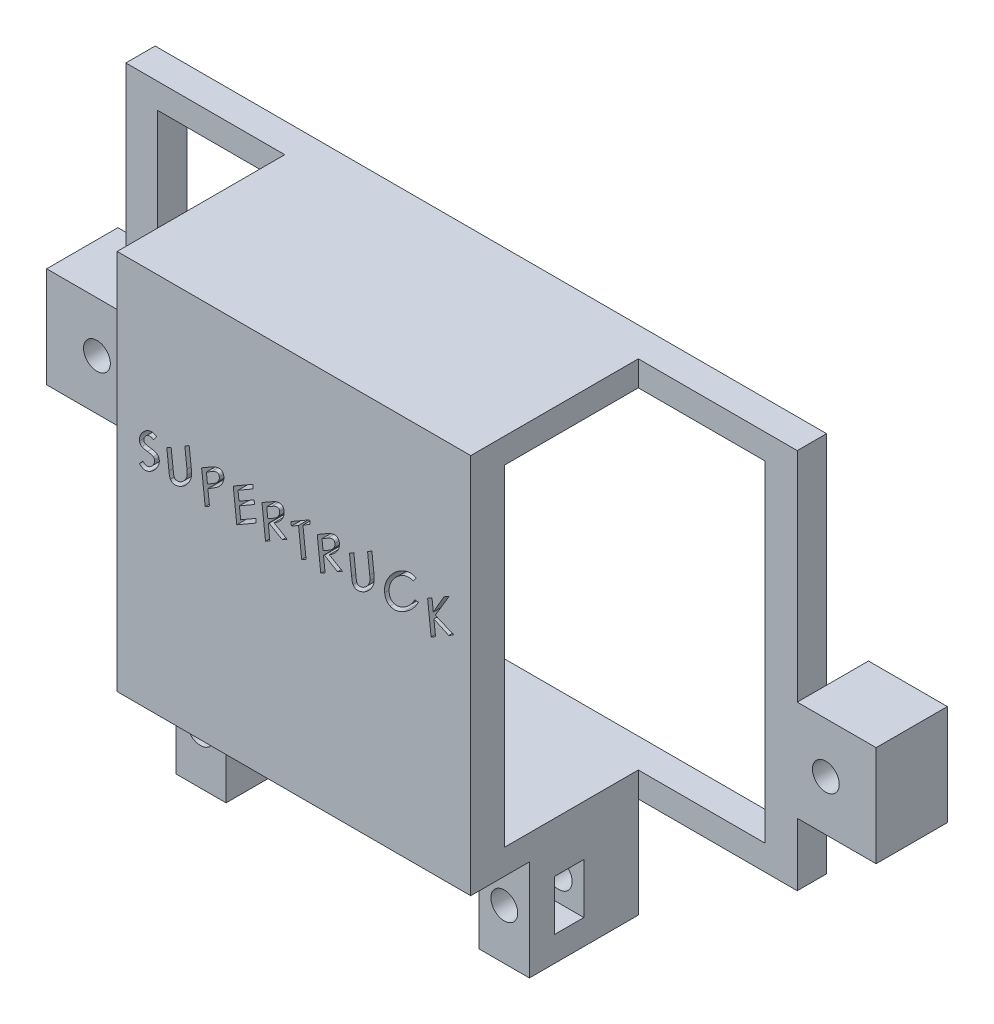
from build123d import *

# Parameters (mm, degrees)
ESBO_O1_W                  = 9.447833945
ESBO_O1_H                  = 12
ESBO_O1_R                  = 1.6
RESSALTO_EXTRUS_O1_DEPTH   = 5
ESBO_O1_W_2                = 9.41398894
RESSALTO_EXTRUS_O1_2_DEPTH = 5
ESBO_O2_W                  = 72.5
ESBO_O2_H                  = 39.5
ESBO_O2_W_2                = 9.447833945
ESBO_O2_H_2                = 12
ESBO_O2_R                  = 1.6
ESBO_O2_W_3                = 9.41398894
RESSALTO_EXTRUS_O2_DEPTH   = 3.5
ESBO_O4_W                  = 6
ESBO_O4_H                  = 12
RESSALTO_EXTRUS_O4_DEPTH   = 13
ESBO_O5_W                  = 42.2
ESBO_O5_H                  = 3
RESSALTO_EXTRUS_O5_DEPTH   = 16
ESBO_O6_W                  = 42.2
ESBO_O6_H                  = 3
RESSALTO_EXTRUS_O6_DEPTH   = 4
ESBO_O8_W                  = 42.2
ESBO_O8_H                  = 3
RESSALTO_EXTRUS_O7_DEPTH   = 10
RESSALTO_EXTRUS_O8_REACH   = 108.375
ESBO_O7_W                  = 42.2
ESBO_O7_H                  = 4
ESBO_O10_W                 = 42.2
ESBO_O10_H                 = 3
CORTE_EXTRUS_O1_DEPTH      = 3
ESBO_O11_R                 = 1.6
CORTE_EXTRUS_O4_DEPTH      = 99.089563665
CORTE_EXTRUS_O5_DEPTH      = 88.180679219
CORTE_EXTRUS_O7_DEPTH      = 100.85771127


with BuildPart() as part:
    # Esboço1 → Ressalto-extrusão1 (new body)
    with BuildSketch(Plane.XY):
        with Locations((-81.026083027, 10.5)):
            Rectangle(ESBO_O1_W, ESBO_O1_H)
        with Locations((-79.75, 10.5)):
            Circle(ESBO_O1_R, mode=Mode.SUBTRACT)
    extrude(amount=RESSALTO_EXTRUS_O1_DEPTH)



with BuildPart() as body_2:
    # Esboço1 → Ressalto-extrus_o1 2 (new body)
    with BuildSketch(Plane.XY):
        with Locations((8.54300553, 10.5)):
            Rectangle(ESBO_O1_W_2, ESBO_O1_H)
        with Locations((7.25, 10.5)):
            Circle(ESBO_O1_R, mode=Mode.SUBTRACT)
    extrude(amount=RESSALTO_EXTRUS_O1_2_DEPTH)


with BuildPart() as part_1:
    add(part.part)

    add(body_2.part)  # Ressalto-extrusão2 merges body 2
    # Esboço2 → Ressalto-extrusão2 (add)
    # profile 1 of 3: a face of its own
    with BuildSketch(Plane.XY.offset(5)):
        Polygon((-76.302166055, 42.5), (-76.302166055, 16.5), (-76.302166055, 4.5), (-76.302166055, -3), (3.83601106, -3), (3.83601106, 4.5), (3.83601106, 16.5), (3.83601106, 42.5), align=None)
        with Locations((-36.25, 19.75)):
            Rectangle(ESBO_O2_W, ESBO_O2_H, mode=Mode.SUBTRACT)
    # profile 2 of 3: a face of its own
    with BuildSketch(Plane.XY.offset(5)):
        with Locations((-81.026083027, 10.5)):
            Rectangle(ESBO_O2_W_2, ESBO_O2_H_2)
        with Locations((-79.75, 10.5)):
            Circle(ESBO_O2_R, mode=Mode.SUBTRACT)
    # profile 3 of 3: a face of its own
    with BuildSketch(Plane.XY.offset(5)):
        with Locations((8.54300553, 10.5)):
            Rectangle(ESBO_O2_W_3, ESBO_O2_H_2)
        with Locations((7.25, 10.5)):
            Circle(ESBO_O2_R, mode=Mode.SUBTRACT)
    extrude(amount=RESSALTO_EXTRUS_O2_DEPTH)

    # Esboço4 → Ressalto-extrusão4 (add)
    with BuildSketch(Plane.XY.offset(8.5)):
        Polygon((-57.333077498, -3), (-51.333077498, -3), (-21.133077498, -3), (-15.133077498, -3), (-15.133077498, 0), (-51.333077498, 0), (-57.333077498, 0), align=None)
        with Locations((-18.133077498, -9)):
            Rectangle(ESBO_O4_W, ESBO_O4_H)
        with Locations((-54.333077498, -9)):
            Rectangle(ESBO_O4_W, ESBO_O4_H)
    extrude(amount=RESSALTO_EXTRUS_O4_DEPTH)

    # Esboço5 → Ressalto-extrusão5 (add)
    with BuildSketch(Plane.XY.offset(8.5)):
        with Locations((-36.233077498, 41)):
            Rectangle(ESBO_O5_W, ESBO_O5_H)
    extrude(amount=RESSALTO_EXTRUS_O5_DEPTH)

    # Esboço6 → Ressalto-extrusão6 (add)
    with BuildSketch(Plane.XY.offset(24.5)):
        with Locations((-36.233077498, 41)):
            Rectangle(ESBO_O6_W, ESBO_O6_H)
    extrude(amount=RESSALTO_EXTRUS_O6_DEPTH)

    # Esboço8 → Ressalto-extrusão7 (add)
    with BuildSketch(Plane.XY.offset(21.5)):
        with Locations((-36.233077498, -1.5)):
            Rectangle(ESBO_O8_W, ESBO_O8_H)
    extrude(amount=RESSALTO_EXTRUS_O7_DEPTH)

    # Esboço7 → Ressalto-extrusão8 (add, up to next)
    with BuildSketch(Plane.XZ.offset(-39.5), mode=Mode.PRIVATE) as ressalto_extrus_o8_sk1:
        with Locations((-36.233077498, 26.5)):
            Rectangle(ESBO_O7_W, ESBO_O7_H)
    ressalto_extrus_o8_tool1 = extrude(ressalto_extrus_o8_sk1.sketch, amount=RESSALTO_EXTRUS_O8_REACH, mode=Mode.PRIVATE) - part_1.part
    add(ressalto_extrus_o8_tool1.solids().sort_by_distance((-36.233077, 39.5, 26.5))[0])

    # Esboço10 → Corte-extrusão1 (cut)
    with BuildSketch(Plane.XY.offset(31.5)):
        with Locations((-36.233077498, -1.5)):
            Rectangle(ESBO_O10_W, ESBO_O10_H)
    extrude(amount=-CORTE_EXTRUS_O1_DEPTH, mode=Mode.SUBTRACT)

    # Esboço11 → Corte-extrusão4 (cut, through all)
    with BuildSketch(Plane.XY.offset(21.5)):
        with Locations((-54.397427999, -9)):
            Circle(ESBO_O11_R)
        with Locations((-18.133077498, -9)):
            Circle(ESBO_O11_R)
    extrude(amount=-CORTE_EXTRUS_O4_DEPTH, mode=Mode.SUBTRACT)

    # Esboço12 → Corte-extrusão5 (cut, through all)
    with BuildSketch(Plane.ZY.offset(57.333077498)):
        Polygon((15, -12), (15, -9), (15, -6), (18.5, -6), (18.5, -12), align=None)
    extrude(amount=-CORTE_EXTRUS_O5_DEPTH, mode=Mode.SUBTRACT)

    # Esboço13 → Corte-extrusão7 (cut, through all)
    # profile 1 of 10: a face of its own
    with BuildSketch(Plane.XY.offset(28.5)):
        with BuildLine():
            Line((-54.669009291, 21.900403758), (-54.277082207, 22.35823629))
            add(Edge.make_bspline(
                [(-54.277082207, 22.35823629), (-54.242022549, 22.326985335), (-54.175384703, 22.267586687), (-54.068839593, 22.195816991), (-53.964018745, 22.142703869), (-53.859854956, 22.109527469), (-53.756649042, 22.096124495), (-53.654789807, 22.103505725), (-53.553811533, 22.13022005), (-53.491529533, 22.162756562), (-53.459574195, 22.179450233)],
                knots=[0, 0, 0, 0, 1.244732154, 2.365860707, 3.397277987, 4.352222213, 5.251935387, 6.14066621, 7.046022277, 8, 8, 8, 8], degree=3))
            add(Edge.make_bspline(
                [(-53.459574195, 22.179450233), (-53.4292957, 22.19807601), (-53.368340376, 22.235572598), (-53.283044445, 22.302023432), (-53.201895653, 22.376282946), (-53.125702509, 22.457168432), (-53.056674653, 22.543414447), (-52.997330885, 22.632192643), (-52.947087804, 22.721861171), (-52.909312279, 22.812756692), (-52.87995353, 22.901722419), (-52.862687278, 22.988090952), (-52.853434832, 23.070236638), (-52.857464585, 23.123389496), (-52.859413938, 23.149101675)],
                knots=[0, 0, 0, 0, 1.068901128, 2.151864326, 3.246859556, 4.376066674, 5.49179471, 6.566370356, 7.586054501, 8.578611649, 9.523706373, 10.399392065, 11.225721447, 12, 12, 12, 12], degree=3))
            add(Edge.make_bspline(
                [(-52.859413938, 23.149101675), (-52.863832356, 23.176298072), (-52.872493454, 23.229609167), (-52.905689237, 23.30319474), (-52.954852057, 23.367269786), (-52.997389449, 23.400062421), (-53.019269707, 23.416930201)],
                knots=[0, 0, 0, 0, 1.02312236, 2.005551405, 2.974101385, 4, 4, 4, 4], degree=3))
            add(Edge.make_bspline(
                [(-53.019269707, 23.416930201), (-53.037514948, 23.428537759), (-53.076152065, 23.453118556), (-53.142202638, 23.48385035), (-53.216889114, 23.514171366), (-53.301641771, 23.541162373), (-53.395502197, 23.56621271), (-53.498906214, 23.589250074), (-53.611858878, 23.610289242), (-53.690667572, 23.621923666), (-53.731609451, 23.627967861)],
                knots=[0, 0, 0, 0, 0.692751556, 1.46700844, 2.331209194, 3.276807417, 4.316630377, 5.445685829, 6.673009073, 8, 8, 8, 8], degree=3))
            add(Edge.make_bspline(
                [(-53.731609451, 23.627967861), (-53.773485697, 23.633768765), (-53.853195512, 23.644810562), (-53.966206977, 23.664827261), (-54.067189705, 23.684405158), (-54.156555475, 23.70336505), (-54.233599914, 23.724625845), (-54.298880044, 23.745159776), (-54.352366476, 23.76618952), (-54.38217528, 23.78353426), (-54.395571791, 23.791329239)],
                knots=[0, 0, 0, 0, 1.476295299, 2.81007097, 4.007383792, 5.068827152, 5.999416712, 6.796980535, 7.459345516, 8, 8, 8, 8], degree=3))
            add(Edge.make_bspline(
                [(-54.395571791, 23.791329239), (-54.415054177, 23.804456172), (-54.453496298, 23.830357881), (-54.505114113, 23.876295068), (-54.5496768, 23.928069733), (-54.587581185, 23.985182138), (-54.61930314, 24.047299558), (-54.644552562, 24.114555872), (-54.663916469, 24.187089182), (-54.670525041, 24.23783705), (-54.673917143, 24.263885329)],
                knots=[0, 0, 0, 0, 0.990566391, 1.954558924, 2.905548645, 3.865648694, 4.840427564, 5.842368085, 6.892513107, 8, 8, 8, 8], degree=3))
            add(Edge.make_bspline(
                [(-54.673917143, 24.263885329), (-54.676905814, 24.306881339), (-54.682971117, 24.394138788), (-54.671125734, 24.527433307), (-54.644305815, 24.664044422), (-54.600270608, 24.802538259), (-54.54281461, 24.941709764), (-54.468893529, 25.077239473), (-54.382404143, 25.20968327), (-54.282677224, 25.336783308), (-54.173148494, 25.456308654), (-54.055647525, 25.564929413), (-53.931446606, 25.660908555), (-53.84334589, 25.715470229), (-53.799618265, 25.742551194)],
                knots=[0, 0, 0, 0, 0.858427771, 1.742120176, 2.658956981, 3.630463543, 4.635439358, 5.657296797, 6.704438357, 7.786926772, 8.87551906, 9.934338066, 10.974736024, 12, 12, 12, 12], degree=3))
            add(Edge.make_bspline(
                [(-53.799618265, 25.742551194), (-53.774775931, 25.756652534), (-53.726017876, 25.784329237), (-53.651312666, 25.819816825), (-53.577833778, 25.851104651), (-53.504816417, 25.87604107), (-53.433337644, 25.896802513), (-53.362523527, 25.911489515), (-53.292752541, 25.92154424), (-53.223130617, 25.92566181), (-53.153125898, 25.924852116), (-53.082308014, 25.915153517), (-53.010197667, 25.899428148), (-52.936296451, 25.877996386), (-52.861473761, 25.847864368), (-52.784883535, 25.812345231), (-52.707333414, 25.769082614), (-52.656378579, 25.736293803), (-52.630147111, 25.719414175)],
                knots=[0, 0, 0, 0, 1.09813329, 2.155306438, 3.178468454, 4.167552244, 5.120578539, 6.038903103, 6.946389381, 7.828785665, 8.718701536, 9.633898418, 10.571674624, 11.555600292, 12.588661064, 13.670193192, 14.800619142, 16, 16, 16, 16], degree=3))
            Line((-52.630147111, 25.719414175), (-53.002442784, 25.21741097))
            add(Edge.make_bspline(
                [(-53.002442784, 25.21741097), (-53.025032075, 25.228796668), (-53.068730183, 25.25082186), (-53.132994454, 25.279844644), (-53.19275499, 25.305684846), (-53.248901457, 25.326191272), (-53.301245576, 25.341412629), (-53.349390881, 25.352957758), (-53.393423594, 25.360423269), (-53.447466156, 25.362967464), (-53.513609015, 25.358246273), (-53.593083284, 25.33889324), (-53.67494089, 25.309074972), (-53.727521474, 25.28009329), (-53.75474647, 25.265087252)],
                knots=[0, 0, 0, 0, 1.141766586, 2.208703196, 3.182545284, 4.080268655, 4.904840155, 5.641815856, 6.314772527, 6.916942086, 8.080482476, 9.293477405, 10.598625893, 12, 12, 12, 12], degree=3))
            add(Edge.make_bspline(
                [(-53.75474647, 25.265087252), (-53.784545656, 25.246498678), (-53.84390082, 25.209473241), (-53.922731277, 25.139261533), (-53.993435705, 25.05969771), (-54.053588864, 24.970765631), (-54.101965175, 24.876889788), (-54.134459472, 24.780334951), (-54.14930644, 24.682857285), (-54.145675288, 24.618442709), (-54.143869066, 24.586401354)],
                knots=[0, 0, 0, 0, 1.02092589, 2.033519409, 3.060210669, 4.113257883, 5.150893171, 6.125584599, 7.067620849, 8, 8, 8, 8], degree=3))
            add(Edge.make_bspline(
                [(-54.143869066, 24.586401354), (-54.141024416, 24.567155941), (-54.13547417, 24.529605879), (-54.120242187, 24.476124164), (-54.098246004, 24.427683459), (-54.069889333, 24.384203924), (-54.034198952, 24.345361183), (-53.989890278, 24.312850986), (-53.938796458, 24.283359763), (-53.900824054, 24.268735519), (-53.880948393, 24.261080842)],
                knots=[0, 0, 0, 0, 1.047632415, 2.044053817, 2.985222503, 3.903877644, 4.830697242, 5.810505775, 6.853966606, 8, 8, 8, 8], degree=3))
            add(Edge.make_bspline(
                [(-53.880948393, 24.261080842), (-53.871616848, 24.258448169), (-53.849353805, 24.252167183), (-53.81036017, 24.243133198), (-53.760362695, 24.234620283), (-53.699938294, 24.223715963), (-53.628600426, 24.212788727), (-53.546567974, 24.200867544), (-53.453785016, 24.188223358), (-53.38830089, 24.179927035), (-53.353704804, 24.175543983)],
                knots=[0, 0, 0, 0, 0.435328968, 1.038600545, 1.796036633, 2.712116024, 3.795558191, 5.036209249, 6.434192093, 8, 8, 8, 8], degree=3))
            add(Edge.make_bspline(
                [(-53.353704804, 24.175543983), (-53.308078342, 24.16960338), (-53.220307197, 24.158175506), (-53.094428653, 24.135751153), (-52.97943545, 24.109664644), (-52.874595021, 24.081843725), (-52.781543076, 24.048390722), (-52.698366154, 24.01401928), (-52.626722841, 23.974578081), (-52.564543821, 23.932218936), (-52.511605713, 23.885893146), (-52.464805, 23.837174314), (-52.4238104, 23.785249451), (-52.389405917, 23.729323593), (-52.36045628, 23.670478582), (-52.338125397, 23.608085543), (-52.320759525, 23.542693907), (-52.314842986, 23.497418687), (-52.311837816, 23.474422188)],
                knots=[0, 0, 0, 0, 1.610547672, 3.098193609, 4.473627786, 5.737929317, 6.891967107, 7.932906222, 8.884879262, 9.749493658, 10.561451409, 11.342613743, 12.111817593, 12.872358272, 13.637067771, 14.403132712, 15.188908249, 16, 16, 16, 16], degree=3))
            add(Edge.make_bspline(
                [(-52.311837816, 23.474422188), (-52.308958352, 23.439856188), (-52.303104524, 23.369584996), (-52.308857277, 23.261893621), (-52.325308793, 23.151231221), (-52.352325034, 23.037343079), (-52.389522394, 22.920050916), (-52.438467654, 22.799788877), (-52.498286964, 22.676561651), (-52.567934677, 22.551659971), (-52.645004099, 22.428170861), (-52.730482939, 22.310710808), (-52.821507135, 22.199705864), (-52.919180281, 22.095706052), (-53.023101152, 21.998923167), (-53.133112531, 21.908731938), (-53.248948988, 21.82502279), (-53.330902566, 21.775739369), (-53.37193397, 21.751064816)],
                knots=[0, 0, 0, 0, 0.78429709, 1.594442284, 2.433763078, 3.313926188, 4.240697132, 5.216067596, 6.249910937, 7.339092539, 8.451505446, 9.542355507, 10.624630763, 11.69861449, 12.768983967, 13.836369355, 14.916742806, 16, 16, 16, 16], degree=3))
            add(Edge.make_bspline(
                [(-53.37193397, 21.751064816), (-53.401910442, 21.734380612), (-53.460390366, 21.701832053), (-53.549250642, 21.659429619), (-53.636664221, 21.624464843), (-53.722548611, 21.596152487), (-53.80658897, 21.574739587), (-53.889465064, 21.561643076), (-53.970523533, 21.554155216), (-54.050649673, 21.554728059), (-54.129673636, 21.563852969), (-54.208478579, 21.582034859), (-54.286215331, 21.611451827), (-54.364243248, 21.649451393), (-54.441091521, 21.698560561), (-54.518499519, 21.756061227), (-54.595196664, 21.823832877), (-54.643885382, 21.874341011), (-54.669009291, 21.900403758)],
                knots=[0, 0, 0, 0, 1.142285649, 2.228440318, 3.276246117, 4.27549367, 5.238185986, 6.160714827, 7.066880425, 7.94638325, 8.823921012, 9.711206441, 10.632158084, 11.585873758, 12.596483439, 13.664302693, 14.794754733, 16, 16, 16, 16], degree=3))
        make_face()
    # profile 2 of 10: a face of its own
    with BuildSketch(Plane.XY.offset(28.5)):
        with BuildLine():
            Line((-51.412298554, 25.180952637), (-50.894169547, 25.480331643))
            Line((-50.894169547, 25.480331643), (-50.640363457, 23.198180201))
            add(Edge.make_bspline(
                [(-50.640363457, 23.198180201), (-50.636581115, 23.16640103), (-50.629434353, 23.106354073), (-50.619934386, 23.020957503), (-50.610177695, 22.945716274), (-50.60065661, 22.880370914), (-50.593647999, 22.825032466), (-50.585520871, 22.779792068), (-50.57911287, 22.744349748), (-50.5738471, 22.724201587), (-50.571653522, 22.715808406)],
                knots=[0, 0, 0, 0, 1.575509933, 2.976936662, 4.229903835, 5.310298412, 6.22798457, 6.975119685, 7.573062485, 8, 8, 8, 8], degree=3))
            add(Edge.make_bspline(
                [(-50.571653522, 22.715808406), (-50.562573835, 22.683902069), (-50.545525977, 22.6239953), (-50.506719672, 22.544199577), (-50.462600611, 22.47807775), (-50.407990702, 22.42734692), (-50.343368936, 22.392224531), (-50.268240439, 22.371214719), (-50.18258373, 22.364563087), (-50.08820519, 22.370047962), (-49.98895764, 22.386627467), (-49.889049198, 22.414826386), (-49.790707317, 22.45444046), (-49.727903621, 22.48826415), (-49.6959524, 22.505471867)],
                knots=[0, 0, 0, 0, 1.099677346, 2.064734564, 2.934582102, 3.725574806, 4.514126639, 5.35424021, 6.297260244, 7.354227996, 8.487307601, 9.632339741, 10.795458842, 12, 12, 12, 12], degree=3))
            add(Edge.make_bspline(
                [(-49.6959524, 22.505471867), (-49.665951558, 22.523683356), (-49.605249606, 22.560531418), (-49.519075127, 22.625507108), (-49.436340657, 22.698865266), (-49.356729646, 22.77901363), (-49.282562902, 22.865069446), (-49.21498952, 22.954951514), (-49.15519554, 23.04772155), (-49.102997681, 23.143484073), (-49.058646873, 23.242325649), (-49.022983626, 23.344674784), (-48.99431773, 23.449790963), (-48.982523049, 23.521735418), (-48.976601438, 23.557855681)],
                knots=[0, 0, 0, 0, 0.958861267, 1.940103884, 2.944915544, 3.9793654, 5.025661686, 6.047788545, 7.050750526, 8.039843127, 9.026415636, 10.008344256, 11.000074001, 12, 12, 12, 12], degree=3))
            add(Edge.make_bspline(
                [(-48.976601438, 23.557855681), (-48.975093094, 23.572569491), (-48.971818449, 23.604513454), (-48.968920496, 23.656910075), (-48.969401162, 23.717730255), (-48.971494007, 23.787160261), (-48.975878841, 23.864993299), (-48.982035308, 23.951513237), (-48.991555491, 24.046328966), (-48.99832463, 24.112444744), (-49.001841823, 24.146797989)],
                knots=[0, 0, 0, 0, 0.601060134, 1.304913073, 2.131209579, 3.07190963, 4.127689037, 5.299024443, 6.596594039, 8, 8, 8, 8], degree=3))
            Line((-49.001841823, 24.146797989), (-49.255647913, 26.428949431))
            Line((-49.255647913, 26.428949431), (-48.738220028, 26.728328438))
            Line((-48.738220028, 26.728328438), (-48.484413938, 24.446176996))
            add(Edge.make_bspline(
                [(-48.484413938, 24.446176996), (-48.48014347, 24.405771242), (-48.471736999, 24.326231998), (-48.464429532, 24.208339904), (-48.459815532, 24.094256815), (-48.460002577, 23.983872474), (-48.463452898, 23.8772472), (-48.470175137, 23.774294975), (-48.481428304, 23.675096912), (-48.49688752, 23.578890896), (-48.517340773, 23.483480032), (-48.544564622, 23.387305649), (-48.580361448, 23.289868278), (-48.621451508, 23.1898455), (-48.670870683, 23.088516222), (-48.726833574, 22.985087896), (-48.791350105, 22.880984476), (-48.86026821, 22.774905619), (-48.936513032, 22.670960811), (-49.018116804, 22.570519911), (-49.106514652, 22.476059146), (-49.198630869, 22.384844513), (-49.298186448, 22.300544621), (-49.4015745, 22.219650514), (-49.510938805, 22.144060687), (-49.587255252, 22.098179989), (-49.62584022, 22.074983085)],
                knots=[0, 0, 0, 0, 1.043143646, 2.053441638, 3.032239226, 3.974369395, 4.886988775, 5.771149395, 6.622696436, 7.449418184, 8.272144766, 9.126920693, 10.013359138, 10.936102475, 11.902310503, 12.906602635, 13.954293092, 15.046114224, 16.153945941, 17.262687422, 18.366742133, 19.474297524, 20.589257385, 21.713976697, 22.844205419, 24, 24, 24, 24], degree=3))
            add(Edge.make_bspline(
                [(-49.62584022, 22.074983085), (-49.664855846, 22.053012992), (-49.740679123, 22.010316137), (-49.855389294, 21.955776127), (-49.966415287, 21.909715235), (-50.074079906, 21.873086631), (-50.178613684, 21.84607646), (-50.279433727, 21.828488282), (-50.377019317, 21.819517658), (-50.470536976, 21.820921251), (-50.559121712, 21.831297561), (-50.641742515, 21.850101732), (-50.717945653, 21.877347428), (-50.787736814, 21.913380726), (-50.850534533, 21.958792299), (-50.907016911, 22.012422022), (-50.956986875, 22.074892377), (-50.98360505, 22.121785521), (-50.997234451, 22.145796387)],
                knots=[0, 0, 0, 0, 1.393156829, 2.707472038, 3.950118529, 5.132355118, 6.243735769, 7.306773745, 8.314291815, 9.289037128, 10.211957887, 11.085312262, 11.920488359, 12.724027213, 13.521353386, 14.323937037, 15.141799419, 16, 16, 16, 16], degree=3))
            add(Edge.make_bspline(
                [(-50.997234451, 22.145796387), (-51.005542052, 22.162705341), (-51.023800929, 22.199868724), (-51.045085471, 22.264218215), (-51.066817043, 22.339987807), (-51.087803652, 22.427921582), (-51.107225147, 22.528294722), (-51.125044661, 22.641085564), (-51.142633757, 22.765898559), (-51.153051854, 22.853206592), (-51.158492464, 22.898801194)],
                knots=[0, 0, 0, 0, 0.584117281, 1.283803392, 2.098809302, 3.031238358, 4.088179357, 5.271115745, 6.574903274, 8, 8, 8, 8], degree=3))
            Line((-51.158492464, 22.898801194), (-51.412298554, 25.180952637))
        make_face()
    # profile 3 of 10: a face of its own
    with BuildSketch(Plane.XY.offset(28.5)):
        with BuildLine():
            Line((-47.25464631, 25.171838053), (-46.445551759, 25.640187412))
            add(Edge.make_bspline(
                [(-46.445551759, 25.640187412), (-46.391870278, 25.67116174), (-46.289250778, 25.730373408), (-46.141312753, 25.813129491), (-46.006923953, 25.886071699), (-45.885978867, 25.949192164), (-45.779195508, 26.00378992), (-45.684871695, 26.047010993), (-45.60480454, 26.082130744), (-45.554984849, 26.099889041), (-45.532691182, 26.107835649)],
                knots=[0, 0, 0, 0, 1.448514325, 2.769033443, 3.961755183, 5.022105838, 5.957697331, 6.764187835, 7.446990051, 8, 8, 8, 8], degree=3))
            add(Edge.make_bspline(
                [(-45.532691182, 26.107835649), (-45.501745826, 26.117671548), (-45.441823636, 26.136717656), (-45.352227656, 26.15648333), (-45.266815941, 26.167751333), (-45.185401613, 26.171483498), (-45.108009231, 26.167710767), (-45.034660481, 26.15487833), (-44.965244324, 26.134748881), (-44.900518707, 26.1057383), (-44.840910039, 26.069525042), (-44.787152333, 26.02546003), (-44.741301565, 25.973022334), (-44.700259739, 25.914244883), (-44.667868702, 25.846975972), (-44.641162958, 25.772740935), (-44.620542394, 25.691038668), (-44.613144588, 25.633516046), (-44.609313778, 25.603729079)],
                knots=[0, 0, 0, 0, 1.242708276, 2.406364398, 3.507338927, 4.537303467, 5.523020175, 6.467422244, 7.381890335, 8.28313013, 9.174724031, 10.045419717, 10.932647778, 11.833576593, 12.781954752, 13.781103496, 14.850987742, 16, 16, 16, 16], degree=3))
            add(Edge.make_bspline(
                [(-44.609313778, 25.603729079), (-44.606421388, 25.572673073), (-44.600622982, 25.510414759), (-44.601970785, 25.41635974), (-44.609593639, 25.321939221), (-44.624446163, 25.227287745), (-44.646069896, 25.132282582), (-44.675874576, 25.037544524), (-44.712540818, 24.942525956), (-44.756064434, 24.847591489), (-44.805422351, 24.752821419), (-44.862673671, 24.660610888), (-44.925115095, 24.569429916), (-44.994907578, 24.480851503), (-45.069893086, 24.392598843), (-45.152044376, 24.306962366), (-45.239627587, 24.222051358), (-45.302405832, 24.16888087), (-45.334273714, 24.141890137)],
                knots=[0, 0, 0, 0, 0.880416654, 1.764980882, 2.652495797, 3.554353694, 4.46868734, 5.401958865, 6.35692225, 7.34355168, 8.350421546, 9.372730919, 10.40726391, 11.470216121, 12.556363338, 13.676947293, 14.820757557, 16, 16, 16, 16], degree=3))
            add(Edge.make_bspline(
                [(-45.334273714, 24.141890137), (-45.358211093, 24.122784362), (-45.409990876, 24.081455994), (-45.497008389, 24.018439412), (-45.598127754, 23.948620487), (-45.71480857, 23.872960129), (-45.845176064, 23.78939114), (-45.991490488, 23.701015715), (-46.151287501, 23.604304168), (-46.26361372, 23.539201067), (-46.322154323, 23.505271547)],
                knots=[0, 0, 0, 0, 0.624846737, 1.351627822, 2.191560067, 3.131936521, 4.188904282, 5.351037701, 6.619451005, 8, 8, 8, 8], degree=3))
            Line((-46.322154323, 23.505271547), (-46.505848233, 23.399402156))
            Line((-46.505848233, 23.399402156), (-46.314441983, 21.676044784))
            Line((-46.314441983, 21.676044784), (-46.83257099, 21.375964656))
            Line((-46.83257099, 21.375964656), (-47.25464631, 25.171838053))
        make_face()
        with BuildLine():
            Line((-46.686737656, 25.022499111), (-46.556329002, 23.85022347))
            Line((-46.556329002, 23.85022347), (-45.996132688, 24.167130521))
            add(Edge.make_bspline(
                [(-45.996132688, 24.167130521), (-45.964976873, 24.185473192), (-45.904700958, 24.220960028), (-45.818514497, 24.274354984), (-45.738903888, 24.325249338), (-45.667191429, 24.375322546), (-45.601041721, 24.421803452), (-45.543543922, 24.468624207), (-45.490970806, 24.511307157), (-45.432760289, 24.56761506), (-45.367629121, 24.637401291), (-45.301767536, 24.727309641), (-45.245059383, 24.820671011), (-45.199902588, 24.917890651), (-45.165160642, 25.015676233), (-45.144407969, 25.112289863), (-45.133808447, 25.205810889), (-45.138002481, 25.266715691), (-45.140062977, 25.296637733)],
                knots=[0, 0, 0, 0, 1.155068263, 2.234664564, 3.239168387, 4.173268604, 5.02912506, 5.820926034, 6.541774964, 7.191389232, 8.406901199, 9.586684072, 10.745583338, 11.891346545, 13.00593204, 14.053126756, 15.043516771, 16, 16, 16, 16], degree=3))
            add(Edge.make_bspline(
                [(-45.140062977, 25.296637733), (-45.144243135, 25.323734188), (-45.15224255, 25.375587671), (-45.179305893, 25.44766529), (-45.218979267, 25.508988723), (-45.270152586, 25.558651057), (-45.330335339, 25.595823227), (-45.398836188, 25.617829586), (-45.474126806, 25.624595723), (-45.541095863, 25.616825428), (-45.600120526, 25.603023003), (-45.651686436, 25.585718973), (-45.710227653, 25.5631647), (-45.775085293, 25.534234474), (-45.846719618, 25.499593078), (-45.925280305, 25.459851038), (-46.010036447, 25.41317784), (-46.068621899, 25.379907133), (-46.099197592, 25.362543181)],
                knots=[0, 0, 0, 0, 1.096166979, 2.097694186, 3.058485907, 3.99862096, 4.931502678, 5.867058289, 6.854528122, 7.937016616, 8.552428615, 9.280750377, 10.11355746, 11.065090751, 12.124499655, 13.301038159, 14.591414341, 16, 16, 16, 16], degree=3))
            Line((-46.099197592, 25.362543181), (-46.686737656, 25.022499111))
        make_face(mode=Mode.SUBTRACT)
    # profile 4 of 10: a face of its own
    with BuildSketch(Plane.XY.offset(28.5)):
        Polygon((-43.480507688, 25.17464254), (-41.147875477, 26.524301996), (-41.097394707, 26.069273951), (-42.911897913, 25.019694624), (-42.792707207, 23.950483887), (-40.993628682, 24.991649752), (-40.943147913, 24.539426194), (-42.742226438, 23.498260329), (-42.590784131, 22.133877316), (-40.791705605, 23.175043181), (-40.741224836, 22.720015137), (-43.058432368, 21.378769143), align=None)
    # profile 5 of 10: a face of its own
    with BuildSketch(Plane.XY.offset(28.5)):
        with BuildLine():
            Line((-40.052022111, 25.185159367), (-39.24292756, 25.653508726))
            add(Edge.make_bspline(
                [(-39.24292756, 25.653508726), (-39.190893373, 25.683568383), (-39.091567002, 25.740948287), (-38.948019416, 25.820855829), (-38.81780131, 25.892489923), (-38.700311347, 25.955290175), (-38.594893387, 26.007419223), (-38.503359996, 26.052343326), (-38.424096971, 26.086738101), (-38.375225706, 26.105632024), (-38.353204002, 26.114145746)],
                knots=[0, 0, 0, 0, 1.43813675, 2.745212607, 3.931699675, 4.995061015, 5.933061402, 6.74609127, 7.434980734, 8, 8, 8, 8], degree=3))
            add(Edge.make_bspline(
                [(-38.353204002, 26.114145746), (-38.321094526, 26.124682984), (-38.25886438, 26.145104803), (-38.165997766, 26.166818513), (-38.077384781, 26.180520341), (-37.993115163, 26.185559729), (-37.913083612, 26.18260256), (-37.837687714, 26.169531397), (-37.766337294, 26.149642769), (-37.700077095, 26.120418783), (-37.638775664, 26.084358893), (-37.584411471, 26.039670636), (-37.536775514, 25.987720982), (-37.496040269, 25.928469477), (-37.462224804, 25.861952389), (-37.435799412, 25.788138257), (-37.415165848, 25.707404981), (-37.40772466, 25.650578792), (-37.403885092, 25.621257124)],
                knots=[0, 0, 0, 0, 1.270489198, 2.462286483, 3.582300532, 4.638849111, 5.633049086, 6.586754278, 7.510376654, 8.411774492, 9.302654511, 10.177123272, 11.048050942, 11.945282281, 12.872994272, 13.846224994, 14.888676548, 16, 16, 16, 16], degree=3))
            add(Edge.make_bspline(
                [(-37.403885092, 25.621257124), (-37.400069564, 25.570312018), (-37.392322032, 25.466866613), (-37.408403565, 25.308970316), (-37.442276298, 25.147682121), (-37.496544609, 24.984345172), (-37.569947499, 24.82095046), (-37.664399294, 24.661308899), (-37.777156215, 24.504712726), (-37.910050711, 24.353426837), (-38.059923803, 24.206690479), (-38.228379152, 24.067893952), (-38.412130377, 23.934162687), (-38.544459319, 23.853953196), (-38.611917945, 23.813064015)],
                knots=[0, 0, 0, 0, 0.80008107, 1.624586081, 2.478812466, 3.381966318, 4.318933115, 5.283496082, 6.286760888, 7.341785163, 8.438457194, 9.573500909, 10.763019705, 12, 12, 12, 12], degree=3))
            Line((-38.611917945, 23.813064015), (-37.041405124, 22.887583246))
            Line((-37.041405124, 22.887583246), (-37.627542945, 22.548240297))
            Line((-37.627542945, 22.548240297), (-39.1959524, 23.474422188))
            Line((-39.1959524, 23.474422188), (-39.303224034, 23.41272347))
            Line((-39.303224034, 23.41272347), (-39.111817784, 21.689366098))
            Line((-39.111817784, 21.689366098), (-39.629946791, 21.38928597))
            Line((-39.629946791, 21.38928597), (-40.052022111, 25.185159367))
        make_face()
        with BuildLine():
            Line((-39.483412336, 25.033015938), (-39.353003682, 23.86214254))
            Line((-39.353003682, 23.86214254), (-38.782991663, 24.187463053))
            add(Edge.make_bspline(
                [(-38.782991663, 24.187463053), (-38.752556489, 24.205367284), (-38.693722721, 24.239977679), (-38.609272053, 24.291649939), (-38.532216162, 24.342742512), (-38.460570461, 24.390199143), (-38.396551208, 24.437922375), (-38.338299604, 24.482904132), (-38.2871837, 24.527051981), (-38.228391198, 24.582932488), (-38.164028625, 24.653832437), (-38.096763257, 24.742932138), (-38.041288124, 24.837081757), (-37.995595095, 24.933821644), (-37.962158322, 25.031754359), (-37.940933395, 25.12813334), (-37.930329801, 25.221732883), (-37.935102504, 25.282847476), (-37.937438778, 25.312763534)],
                knots=[0, 0, 0, 0, 1.135607923, 2.195226257, 3.183340362, 4.108903771, 4.958241504, 5.750597167, 6.47533301, 7.129222298, 8.358284299, 9.550317902, 10.712987507, 11.866290821, 12.985766561, 14.032511952, 15.036899638, 16, 16, 16, 16], degree=3))
            add(Edge.make_bspline(
                [(-37.937438778, 25.312763534), (-37.941603169, 25.339862506), (-37.949539184, 25.391504592), (-37.976528956, 25.462989343), (-38.01640044, 25.523125181), (-38.067803974, 25.571309795), (-38.127578774, 25.607605452), (-38.195576862, 25.629167116), (-38.270089137, 25.634644413), (-38.336629169, 25.628148211), (-38.395390604, 25.614201786), (-38.446957245, 25.596944927), (-38.505511597, 25.574402659), (-38.5704969, 25.545257461), (-38.642890238, 25.510975425), (-38.722051911, 25.470101084), (-38.808000208, 25.423212403), (-38.867189275, 25.389297911), (-38.897975637, 25.371657765)],
                knots=[0, 0, 0, 0, 1.097516208, 2.091519411, 3.037838851, 3.966160081, 4.895332766, 5.820240342, 6.798741918, 7.872299426, 8.488468912, 9.217687136, 10.051519288, 11.004223784, 12.073393632, 13.263992927, 14.576904327, 16, 16, 16, 16], degree=3))
            Line((-38.897975637, 25.371657765), (-39.483412336, 25.033015938))
        make_face(mode=Mode.SUBTRACT)
    # profile 6 of 10: a face of its own
    with BuildSketch(Plane.XY.offset(28.5)):
        Polygon((-36.544309772, 24.503668983), (-36.594089419, 24.953088053), (-34.355407528, 26.24876113), (-34.305627881, 25.79934206), (-35.16099647, 25.304350072), (-34.788700797, 21.957895746), (-35.314542143, 21.653608887), (-35.686837816, 25.000063213), align=None)
    # profile 7 of 10: a face of its own
    with BuildSketch(Plane.XY.offset(28.5)):
        with BuildLine():
            Line((-33.455868265, 25.185159367), (-32.646773714, 25.653508726))
            add(Edge.make_bspline(
                [(-32.646773714, 25.653508726), (-32.594739527, 25.683568383), (-32.495413156, 25.740948287), (-32.35186557, 25.820855829), (-32.221647464, 25.892489923), (-32.104157501, 25.955290175), (-31.998739541, 26.007419223), (-31.90720615, 26.052343326), (-31.827943125, 26.086738101), (-31.77907186, 26.105632024), (-31.757050156, 26.114145746)],
                knots=[0, 0, 0, 0, 1.43813675, 2.745212607, 3.931699675, 4.995061015, 5.933061402, 6.74609127, 7.434980734, 8, 8, 8, 8], degree=3))
            add(Edge.make_bspline(
                [(-31.757050156, 26.114145746), (-31.72494068, 26.124682984), (-31.662710534, 26.145104803), (-31.56984392, 26.166818513), (-31.481230935, 26.180520341), (-31.396961317, 26.185559729), (-31.316929766, 26.18260256), (-31.241533868, 26.169531397), (-31.170183448, 26.149642769), (-31.103923249, 26.120418783), (-31.042621817, 26.084358893), (-30.988257625, 26.039670636), (-30.940621668, 25.987720982), (-30.899886423, 25.928469477), (-30.866070957, 25.861952389), (-30.839645566, 25.788138257), (-30.819012002, 25.707404981), (-30.811570814, 25.650578792), (-30.807731246, 25.621257124)],
                knots=[0, 0, 0, 0, 1.270489198, 2.462286483, 3.582300532, 4.638849111, 5.633049086, 6.586754278, 7.510376654, 8.411774492, 9.302654511, 10.177123272, 11.048050942, 11.945282281, 12.872994272, 13.846224994, 14.888676548, 16, 16, 16, 16], degree=3))
            add(Edge.make_bspline(
                [(-30.807731246, 25.621257124), (-30.803915718, 25.570312018), (-30.796168186, 25.466866613), (-30.812249719, 25.308970316), (-30.846122452, 25.147682121), (-30.900390763, 24.984345172), (-30.973793653, 24.82095046), (-31.068245448, 24.661308899), (-31.181002369, 24.504712726), (-31.313896865, 24.353426837), (-31.463769956, 24.206690479), (-31.632225306, 24.067893952), (-31.815976531, 23.934162687), (-31.948305473, 23.853953196), (-32.015764098, 23.813064015)],
                knots=[0, 0, 0, 0, 0.80008107, 1.624586081, 2.478812466, 3.381966318, 4.318933115, 5.283496082, 6.286760888, 7.341785163, 8.438457194, 9.573500909, 10.763019705, 12, 12, 12, 12], degree=3))
            Line((-32.015764098, 23.813064015), (-30.445251278, 22.887583246))
            Line((-30.445251278, 22.887583246), (-31.031389098, 22.548240297))
            Line((-31.031389098, 22.548240297), (-32.599798554, 23.474422188))
            Line((-32.599798554, 23.474422188), (-32.707070188, 23.41272347))
            Line((-32.707070188, 23.41272347), (-32.515663938, 21.689366098))
            Line((-32.515663938, 21.689366098), (-33.033792945, 21.38928597))
            Line((-33.033792945, 21.38928597), (-33.455868265, 25.185159367))
        make_face()
        with BuildLine():
            Line((-32.88725849, 25.033015938), (-32.756849836, 23.86214254))
            Line((-32.756849836, 23.86214254), (-32.186837816, 24.187463053))
            add(Edge.make_bspline(
                [(-32.186837816, 24.187463053), (-32.156402642, 24.205367284), (-32.097568874, 24.239977679), (-32.013118207, 24.291649939), (-31.936062316, 24.342742512), (-31.864416615, 24.390199143), (-31.800397362, 24.437922375), (-31.742145757, 24.482904132), (-31.691029854, 24.527051981), (-31.632237352, 24.582932488), (-31.567874779, 24.653832437), (-31.500609411, 24.742932138), (-31.445134278, 24.837081757), (-31.399441249, 24.933821644), (-31.366004475, 25.031754359), (-31.344779549, 25.12813334), (-31.334175954, 25.221732883), (-31.338948657, 25.282847476), (-31.341284932, 25.312763534)],
                knots=[0, 0, 0, 0, 1.135607923, 2.195226257, 3.183340362, 4.108903771, 4.958241504, 5.750597167, 6.47533301, 7.129222298, 8.358284299, 9.550317902, 10.712987507, 11.866290821, 12.985766561, 14.032511952, 15.036899638, 16, 16, 16, 16], degree=3))
            add(Edge.make_bspline(
                [(-31.341284932, 25.312763534), (-31.345449323, 25.339862506), (-31.353385338, 25.391504592), (-31.38037511, 25.462989343), (-31.420246594, 25.523125181), (-31.471650128, 25.571309795), (-31.531424928, 25.607605452), (-31.599423016, 25.629167116), (-31.673935291, 25.634644413), (-31.740475323, 25.628148211), (-31.799236758, 25.614201786), (-31.850803399, 25.596944927), (-31.909357751, 25.574402659), (-31.974343054, 25.545257461), (-32.046736392, 25.510975425), (-32.125898065, 25.470101084), (-32.211846362, 25.423212403), (-32.271035429, 25.389297911), (-32.301821791, 25.371657765)],
                knots=[0, 0, 0, 0, 1.097516208, 2.091519411, 3.037838851, 3.966160081, 4.895332766, 5.820240342, 6.798741918, 7.872299426, 8.488468912, 9.217687136, 10.051519288, 11.004223784, 12.073393632, 13.263992927, 14.576904327, 16, 16, 16, 16], degree=3))
            Line((-32.301821791, 25.371657765), (-32.88725849, 25.033015938))
        make_face(mode=Mode.SUBTRACT)
    # profile 8 of 10: a face of its own
    with BuildSketch(Plane.XY.offset(28.5)):
        with BuildLine():
            Line((-29.604606246, 25.180952637), (-29.08647724, 25.480331643))
            Line((-29.08647724, 25.480331643), (-28.83267115, 23.198180201))
            add(Edge.make_bspline(
                [(-28.83267115, 23.198180201), (-28.828888807, 23.16640103), (-28.821742046, 23.106354073), (-28.812242078, 23.020957503), (-28.802485388, 22.945716274), (-28.792964302, 22.880370914), (-28.785955691, 22.825032466), (-28.777828564, 22.779792068), (-28.771420562, 22.744349748), (-28.766154792, 22.724201587), (-28.763961214, 22.715808406)],
                knots=[0, 0, 0, 0, 1.575509933, 2.976936662, 4.229903835, 5.310298412, 6.22798457, 6.975119685, 7.573062485, 8, 8, 8, 8], degree=3))
            add(Edge.make_bspline(
                [(-28.763961214, 22.715808406), (-28.754881527, 22.683902069), (-28.737833669, 22.6239953), (-28.699027365, 22.544199577), (-28.654908303, 22.47807775), (-28.600298394, 22.42734692), (-28.535676629, 22.392224531), (-28.460548131, 22.371214719), (-28.374891422, 22.364563087), (-28.280512882, 22.370047962), (-28.181265332, 22.386627467), (-28.08135689, 22.414826386), (-27.983015009, 22.45444046), (-27.920211313, 22.48826415), (-27.888260092, 22.505471867)],
                knots=[0, 0, 0, 0, 1.099677346, 2.064734564, 2.934582102, 3.725574806, 4.514126639, 5.35424021, 6.297260244, 7.354227996, 8.487307601, 9.632339741, 10.795458842, 12, 12, 12, 12], degree=3))
            add(Edge.make_bspline(
                [(-27.888260092, 22.505471867), (-27.85825925, 22.523683356), (-27.797557298, 22.560531418), (-27.71138282, 22.625507108), (-27.62864835, 22.698865266), (-27.549037339, 22.77901363), (-27.474870594, 22.865069446), (-27.407297212, 22.954951514), (-27.347503232, 23.04772155), (-27.295305374, 23.143484073), (-27.250954566, 23.242325649), (-27.215291318, 23.344674784), (-27.186625423, 23.449790963), (-27.174830741, 23.521735418), (-27.168909131, 23.557855681)],
                knots=[0, 0, 0, 0, 0.958861267, 1.940103884, 2.944915544, 3.9793654, 5.025661686, 6.047788545, 7.050750526, 8.039843127, 9.026415636, 10.008344256, 11.000074001, 12, 12, 12, 12], degree=3))
            add(Edge.make_bspline(
                [(-27.168909131, 23.557855681), (-27.167400786, 23.572569491), (-27.164126141, 23.604513454), (-27.161228188, 23.656910075), (-27.161708855, 23.717730255), (-27.1638017, 23.787160261), (-27.168186534, 23.864993299), (-27.174343, 23.951513237), (-27.183863183, 24.046328966), (-27.190632323, 24.112444744), (-27.194149515, 24.146797989)],
                knots=[0, 0, 0, 0, 0.601060134, 1.304913073, 2.131209579, 3.07190963, 4.127689037, 5.299024443, 6.596594039, 8, 8, 8, 8], degree=3))
            Line((-27.194149515, 24.146797989), (-27.447955605, 26.428949431))
            Line((-27.447955605, 26.428949431), (-26.93052772, 26.728328438))
            Line((-26.93052772, 26.728328438), (-26.676721631, 24.446176996))
            add(Edge.make_bspline(
                [(-26.676721631, 24.446176996), (-26.672451162, 24.405771242), (-26.664044691, 24.326231998), (-26.656737224, 24.208339904), (-26.652123225, 24.094256815), (-26.652310269, 23.983872474), (-26.655760591, 23.8772472), (-26.662482829, 23.774294975), (-26.673735996, 23.675096912), (-26.689195213, 23.578890896), (-26.709648465, 23.483480032), (-26.736872315, 23.387305649), (-26.77266914, 23.289868278), (-26.813759201, 23.1898455), (-26.863178376, 23.088516222), (-26.919141266, 22.985087896), (-26.983657797, 22.880984476), (-27.052575902, 22.774905619), (-27.128820724, 22.670960811), (-27.210424496, 22.570519911), (-27.298822345, 22.476059146), (-27.390938562, 22.384844513), (-27.490494141, 22.300544621), (-27.593882192, 22.219650514), (-27.703246497, 22.144060687), (-27.779562945, 22.098179989), (-27.818147913, 22.074983085)],
                knots=[0, 0, 0, 0, 1.043143646, 2.053441638, 3.032239226, 3.974369395, 4.886988775, 5.771149395, 6.622696436, 7.449418184, 8.272144766, 9.126920693, 10.013359138, 10.936102475, 11.902310503, 12.906602635, 13.954293092, 15.046114224, 16.153945941, 17.262687422, 18.366742133, 19.474297524, 20.589257385, 21.713976697, 22.844205419, 24, 24, 24, 24], degree=3))
            add(Edge.make_bspline(
                [(-27.818147913, 22.074983085), (-27.857163538, 22.053012992), (-27.932986815, 22.010316137), (-28.047696986, 21.955776127), (-28.15872298, 21.909715235), (-28.266387599, 21.873086631), (-28.370921376, 21.84607646), (-28.471741419, 21.828488282), (-28.56932701, 21.819517658), (-28.662844668, 21.820921251), (-28.751429404, 21.831297561), (-28.834050207, 21.850101732), (-28.910253345, 21.877347428), (-28.980044506, 21.913380726), (-29.042842225, 21.958792299), (-29.099324603, 22.012422022), (-29.149294567, 22.074892377), (-29.175912743, 22.121785521), (-29.189542143, 22.145796387)],
                knots=[0, 0, 0, 0, 1.393156829, 2.707472038, 3.950118529, 5.132355118, 6.243735769, 7.306773745, 8.314291815, 9.289037128, 10.211957887, 11.085312262, 11.920488359, 12.724027213, 13.521353386, 14.323937037, 15.141799419, 16, 16, 16, 16], degree=3))
            add(Edge.make_bspline(
                [(-29.189542143, 22.145796387), (-29.197849744, 22.162705341), (-29.216108621, 22.199868724), (-29.237393163, 22.264218215), (-29.259124735, 22.339987807), (-29.280111344, 22.427921582), (-29.299532839, 22.528294722), (-29.317352353, 22.641085564), (-29.334941449, 22.765898559), (-29.345359546, 22.853206592), (-29.350800156, 22.898801194)],
                knots=[0, 0, 0, 0, 0.584117281, 1.283803392, 2.098809302, 3.031238358, 4.088179357, 5.271115745, 6.574903274, 8, 8, 8, 8], degree=3))
            Line((-29.350800156, 22.898801194), (-29.604606246, 25.180952637))
        make_face()
    # profile 9 of 10: a face of its own
    with BuildSketch(Plane.XY.offset(28.5)):
        with BuildLine():
            Line((-21.655988457, 26.579690617), (-22.017066182, 26.090307604))
            add(Edge.make_bspline(
                [(-22.017066182, 26.090307604), (-22.043536838, 26.10308024), (-22.095933247, 26.128362584), (-22.177266345, 26.159365814), (-22.259812553, 26.18374702), (-22.343899554, 26.202325846), (-22.429275918, 26.213790999), (-22.516137534, 26.220651662), (-22.6042908, 26.219633499), (-22.693692358, 26.212324468), (-22.784682773, 26.200001336), (-22.87679654, 26.180001079), (-22.970535493, 26.154437497), (-23.066099231, 26.123969325), (-23.162624047, 26.085564448), (-23.26115571, 26.041979938), (-23.361290102, 25.992574408), (-23.427203655, 25.955094104), (-23.460675957, 25.93606081)],
                knots=[0, 0, 0, 0, 0.928988681, 1.838853967, 2.748359102, 3.64844969, 4.558674987, 5.470009419, 6.401111709, 7.342478888, 8.304955321, 9.302068128, 10.320233853, 11.37648845, 12.471526828, 13.602960316, 14.78273233, 16, 16, 16, 16], degree=3))
            add(Edge.make_bspline(
                [(-23.460675957, 25.93606081), (-23.495915515, 25.914853666), (-23.566647516, 25.872287194), (-23.669807867, 25.802847277), (-23.770011772, 25.727463631), (-23.868194203, 25.647685919), (-23.963826321, 25.5627242), (-24.056467029, 25.471947285), (-24.146728675, 25.375823564), (-24.234705388, 25.275498597), (-24.318413955, 25.171789597), (-24.396408789, 25.065325806), (-24.469519198, 24.957504974), (-24.536764132, 24.847460944), (-24.598329819, 24.735673046), (-24.655762565, 24.622954159), (-24.705721752, 24.507609583), (-24.75154254, 24.391623675), (-24.790965828, 24.275003914), (-24.822297264, 24.158237091), (-24.847578857, 24.042427995), (-24.86706817, 23.927393913), (-24.877835825, 23.812799806), (-24.883000759, 23.698841909), (-24.881245305, 23.585453619), (-24.874158704, 23.510381424), (-24.870631887, 23.473019944)],
                knots=[0, 0, 0, 0, 0.991804234, 1.990725818, 2.997377342, 4.014983165, 5.040998903, 6.0812822, 7.141903616, 8.220376315, 9.29868699, 10.354986426, 11.402376116, 12.439601099, 13.463881451, 14.479706247, 15.489225506, 16.494029165, 17.486809861, 18.456211734, 19.408086476, 20.344890121, 21.268029536, 22.181969145, 23.095213293, 24, 24, 24, 24], degree=3))
            add(Edge.make_bspline(
                [(-24.870631887, 23.473019944), (-24.863466685, 23.419267256), (-24.849703051, 23.316013732), (-24.809814278, 23.170427751), (-24.757737983, 23.040217214), (-24.691366284, 22.925474725), (-24.610770287, 22.826815733), (-24.516253918, 22.744214504), (-24.407905937, 22.678482209), (-24.287717077, 22.628911757), (-24.158050781, 22.596366343), (-24.021516152, 22.580655956), (-23.879549955, 22.5844733), (-23.732216749, 22.603929445), (-23.579961748, 22.643285008), (-23.421865098, 22.6979203), (-23.258503921, 22.771668161), (-23.150597662, 22.831396848), (-23.094690381, 22.862342861)],
                knots=[0, 0, 0, 0, 1.111999954, 2.136040388, 3.089192321, 3.983504618, 4.845854642, 5.692423383, 6.54721537, 7.435395669, 8.351028777, 9.282841698, 10.247225923, 11.258752293, 12.326789251, 13.469125755, 14.688729459, 16, 16, 16, 16], degree=3))
            add(Edge.make_bspline(
                [(-23.094690381, 22.862342861), (-23.02998655, 22.901765381), (-22.900347611, 22.980751332), (-22.717160428, 23.118051286), (-22.542669923, 23.269769633), (-22.377923076, 23.437502859), (-22.221143985, 23.619078944), (-22.074616674, 23.816637528), (-21.935809137, 24.028187178), (-21.852981354, 24.178014425), (-21.810936374, 24.254069624)],
                knots=[0, 0, 0, 0, 0.947473589, 1.898333821, 2.859936053, 3.837886841, 4.837201217, 5.858813632, 6.913092528, 8, 8, 8, 8], degree=3))
            Line((-21.810936374, 24.254069624), (-21.393067784, 24.215507925))
            add(Edge.make_bspline(
                [(-21.393067784, 24.215507925), (-21.415340189, 24.169265977), (-21.459897928, 24.076755237), (-21.533796615, 23.941787763), (-21.612582586, 23.809403716), (-21.696509085, 23.680043249), (-21.785538637, 23.553678891), (-21.880088846, 23.430858072), (-21.978441088, 23.309974323), (-22.083226856, 23.193436858), (-22.191350412, 23.079395277), (-22.30556094, 22.971221694), (-22.422159452, 22.865852422), (-22.543270862, 22.765216847), (-22.668456792, 22.669385626), (-22.798131103, 22.578235985), (-22.930844877, 22.490073959), (-23.02269041, 22.435889396), (-23.068748874, 22.40871706)],
                knots=[0, 0, 0, 0, 0.984402013, 1.969375498, 2.950403145, 3.938951013, 4.926522558, 5.914623064, 6.911672985, 7.915002095, 8.920122338, 9.925242581, 10.931561798, 11.934319876, 12.944834247, 13.954811496, 14.974384074, 16, 16, 16, 16], degree=3))
            add(Edge.make_bspline(
                [(-23.068748874, 22.40871706), (-23.110893002, 22.384828917), (-23.193503778, 22.33800346), (-23.317525847, 22.274015733), (-23.439245296, 22.218168808), (-23.557597299, 22.167654904), (-23.673903851, 22.125958494), (-23.787051765, 22.090614904), (-23.897164444, 22.062104863), (-24.004777976, 22.042188889), (-24.109295878, 22.027381706), (-24.211254206, 22.021585288), (-24.310345315, 22.020962905), (-24.40698066, 22.028716024), (-24.500648864, 22.044324266), (-24.591627608, 22.066063825), (-24.679910285, 22.094392119), (-24.73600049, 22.119775993), (-24.764061374, 22.132475072)],
                knots=[0, 0, 0, 0, 1.301138938, 2.550488157, 3.746975615, 4.897680594, 6.005712525, 7.063993785, 8.08103326, 9.058579479, 10.002304036, 10.914282106, 11.799398819, 12.662173531, 13.514609736, 14.347451388, 15.173260704, 16, 16, 16, 16], degree=3))
            add(Edge.make_bspline(
                [(-24.764061374, 22.132475072), (-24.786912095, 22.144063391), (-24.832329226, 22.167095845), (-24.896938614, 22.207339438), (-24.95781705, 22.251690243), (-25.015959993, 22.299138215), (-25.068892169, 22.352188302), (-25.119036788, 22.408388315), (-25.165469742, 22.468676997), (-25.207262601, 22.533492114), (-25.246348393, 22.601862979), (-25.28092174, 22.674718958), (-25.312877655, 22.751272802), (-25.339954617, 22.832240346), (-25.363724861, 22.916969352), (-25.384094138, 23.005869008), (-25.401103044, 23.098706191), (-25.408729774, 23.162374047), (-25.412599034, 23.194674592)],
                knots=[0, 0, 0, 0, 0.943067464, 1.874401189, 2.798751358, 3.715459148, 4.634305151, 5.554761613, 6.487644549, 7.43282977, 8.392399832, 9.385420188, 10.400201289, 11.445182238, 12.526762036, 13.639391174, 14.802394874, 16, 16, 16, 16], degree=3))
            add(Edge.make_bspline(
                [(-25.412599034, 23.194674592), (-25.418401843, 23.264501683), (-25.430075841, 23.404978718), (-25.422717954, 23.618264567), (-25.395759471, 23.833798176), (-25.349021966, 24.051859647), (-25.282623699, 24.272600996), (-25.196450803, 24.495974567), (-25.091081246, 24.722177978), (-24.965857775, 24.947759956), (-24.826857893, 25.169670519), (-24.673540578, 25.38067992), (-24.509899231, 25.580166883), (-24.334087103, 25.766666682), (-24.147758167, 25.942087634), (-23.948341088, 26.1028514), (-23.739347098, 26.253752614), (-23.591740805, 26.342783707), (-23.517466823, 26.387583246)],
                knots=[0, 0, 0, 0, 0.860726542, 1.731596002, 2.617452799, 3.52800925, 4.469651129, 5.448155804, 6.46867477, 7.534613597, 8.6178187, 9.685533053, 10.738665567, 11.787392259, 12.83415354, 13.881829057, 14.934157964, 16, 16, 16, 16], degree=3))
            add(Edge.make_bspline(
                [(-23.517466823, 26.387583246), (-23.47093876, 26.413917402), (-23.380017883, 26.465377198), (-23.242792911, 26.534399819), (-23.107949752, 26.594151055), (-22.975670986, 26.645146864), (-22.846296265, 26.68865932), (-22.719256404, 26.722059825), (-22.59505344, 26.747841168), (-22.473650713, 26.763756855), (-22.355840009, 26.771940485), (-22.242136202, 26.770484869), (-22.132893482, 26.760726354), (-22.028106687, 26.742888941), (-21.928018383, 26.715132411), (-21.832265845, 26.679575428), (-21.741134312, 26.634562218), (-21.684408552, 26.598005732), (-21.655988457, 26.579690617)],
                knots=[0, 0, 0, 0, 1.300496223, 2.541310578, 3.735123297, 4.887057459, 5.989185697, 7.053838493, 8.080781489, 9.073032999, 10.030247586, 10.951373894, 11.836218712, 12.696163589, 13.533405173, 14.359217628, 15.177953919, 16, 16, 16, 16], degree=3))
        make_face()
    # profile 10 of 10: a face of its own
    with BuildSketch(Plane.XY.offset(28.5)):
        Polygon((-20.283893105, 25.173240297), (-19.758752881, 25.477527156), (-19.603804964, 24.087202637), (-18.335475637, 26.300644143), (-17.709373874, 26.663124111), (-19.362619066, 23.888084047), (-17.143568586, 22.950684207), (-17.760555765, 22.593813213), (-19.528784932, 23.409918983), (-19.33667756, 21.681653758), (-19.861817784, 21.377366899), align=None)
    extrude(amount=-CORTE_EXTRUS_O7_DEPTH, mode=Mode.SUBTRACT)


with BuildPart() as corte_extrus_o7_piece_1:
    # of the separate pieces the step leaves, piece 1, a body of its own (corte_extrus_o7_pieces)
    add(part_1.part.solids().sort_by_distance((-76.302166055, 4.5, 0))[0])


with BuildPart() as corte_extrus_o7_piece_2:
    # of the separate pieces the step leaves, piece 2, a body of its own (corte_extrus_o7_pieces)
    add(part_1.part.solids().sort_by_distance((-46.099197592, 25.362543181, 28.5))[0])


with BuildPart() as corte_extrus_o7_piece_3:
    # of the separate pieces the step leaves, piece 3, a body of its own (corte_extrus_o7_pieces)
    add(part_1.part.solids().sort_by_distance((-32.301821791, 25.371657765, 28.5))[0])


with BuildPart() as corte_extrus_o7_piece_4:
    # of the separate pieces the step leaves, piece 4, a body of its own (corte_extrus_o7_pieces)
    add(part_1.part.solids().sort_by_distance((-38.897975637, 25.371657765, 28.5))[0])


solid = Compound([corte_extrus_o7_piece_1.part, corte_extrus_o7_piece_2.part, corte_extrus_o7_piece_3.part, corte_extrus_o7_piece_4.part])
